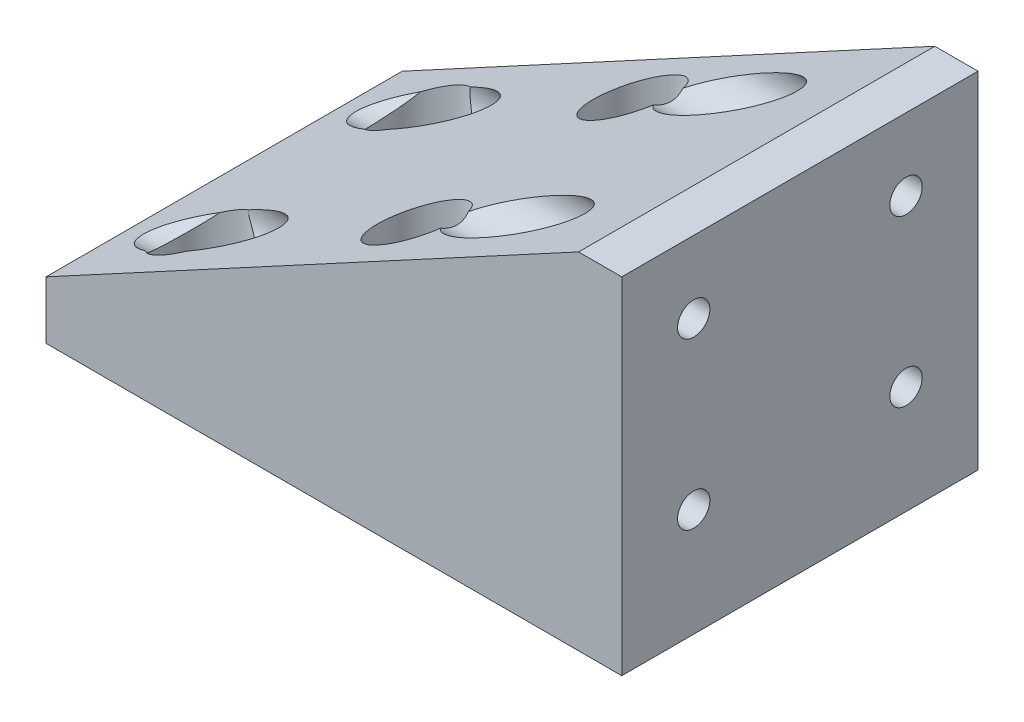
from build123d import *

# Parameters (mm, degrees)
BOSS_EXTRUDE1_DEPTH                           = 40
BOSS_EXTRUDE1_DEPTH_BACK                      = 8
SKETCH1_W                                     = 80
SKETCH1_H                                     = 49.5
CHAMFER1_SIZE                                 = 40
CHAMFER1_SIZE2                                = 74
CSK_FOR_M4_SFHCS1_AT_2_COUNT                  = 2
CSK_FOR_M4_SFHCS1_AT_2_PITCH                  = 30
CSK_FOR_M4_SFHCS1_AT_3_COUNT                  = 2
CSK_FOR_M4_SFHCS1_AT_3_PITCH                  = 42.426406871
CSK_FOR_M4_SFHCS1_AT_4_COUNT                  = 2
CSK_FOR_M4_SFHCS1_AT_4_PITCH                  = 30
SKETCH4_R                                     = 5.48
CUT_EXTRUDE1_DEPTH                            = 62.745951284
CSK_FOR_8_FLAT_HEAD_MACHINE_SCREW1_AT_2_COUNT = 2
CSK_FOR_8_FLAT_HEAD_MACHINE_SCREW1_AT_2_PITCH = 29.5
CSK_FOR_8_FLAT_HEAD_MACHINE_SCREW1_AT_3_COUNT = 2
CSK_FOR_8_FLAT_HEAD_MACHINE_SCREW1_AT_3_PITCH = 37.406550229
CSK_FOR_8_FLAT_HEAD_MACHINE_SCREW1_AT_4_COUNT = 2
CSK_FOR_8_FLAT_HEAD_MACHINE_SCREW1_AT_4_PITCH = 23
SKETCH7_R                                     = 5.0856896
CUT_EXTRUDE2_DEPTH                            = 87.842170056


with BuildPart() as part:
    # Sketch1 → Boss-Extrude1 (new, two sides: drawn at the far end of the back side and taken through both)
    with BuildSketch(Plane(origin=(0, 0, 0), x_dir=(1, 0, 0), z_dir=(0, 1, 0)).offset(-BOSS_EXTRUDE1_DEPTH_BACK)):
        Rectangle(SKETCH1_W, SKETCH1_H)
    extrude(amount=BOSS_EXTRUDE1_DEPTH + BOSS_EXTRUDE1_DEPTH_BACK)

    # Chamfer1
    chamfer1_edges = [part.edges().sort_by_distance(p)[0] for p in [
        (-40, 40, 0),
    ]]
    chamfer1_side = [part.faces().sort_by_distance(p)[0] for p in [
        (-40, 16, 0),
    ]]
    chamfer(chamfer1_edges, length=CHAMFER1_SIZE, length2=CHAMFER1_SIZE2, reference=chamfer1_side[0])

    # Sketch3 → CSK for M4 SFHCS1 (revolve, cut)
    with BuildSketch(Plane(origin=(-28.25, 0, -15), x_dir=(0, 0, 1), z_dir=(1, 0, 0))):
        Polygon((0, 0), (0, 8), (2.25, 8), (2.25, 3.23), (5.48, 0), align=None)
    csk_for_m4_sfhcs1 = revolve(axis=Axis((-28.25, 6.35, -15), (0, -1, 0)), mode=Mode.SUBTRACT)

    # CSK for M4 SFHCS1 at 2: CSK for M4 SFHCS1 ×2
    with Locations(*[(i * CSK_FOR_M4_SFHCS1_AT_2_PITCH, 0, 0) for i in range(1, CSK_FOR_M4_SFHCS1_AT_2_COUNT)]):
        add(csk_for_m4_sfhcs1, mode=Mode.SUBTRACT)

    # CSK for M4 SFHCS1 at 3: CSK for M4 SFHCS1 ×2
    with Locations(*[Vector(0.7071067811865476, 0, 0.7071067811865476) * (i * CSK_FOR_M4_SFHCS1_AT_3_PITCH) for i in range(1, CSK_FOR_M4_SFHCS1_AT_3_COUNT)]):
        add(csk_for_m4_sfhcs1, mode=Mode.SUBTRACT)

    # CSK for M4 SFHCS1 at 4: CSK for M4 SFHCS1 ×2
    with Locations(*[(0, 0, i * CSK_FOR_M4_SFHCS1_AT_4_PITCH) for i in range(1, CSK_FOR_M4_SFHCS1_AT_4_COUNT)]):
        add(csk_for_m4_sfhcs1, mode=Mode.SUBTRACT)

    # Sketch4 → Cut-Extrude1 (cut, through all)
    with BuildSketch(Plane.XZ):
        with Locations(Location((-28.25, -15, 0), (0, 0, 270))):
            Circle(SKETCH4_R)
        with Locations(Location((1.75, -15, 0), (0, 0, 270))):
            Circle(SKETCH4_R)
        with Locations(Location((1.75, 15, 0), (0, 0, 270))):
            Circle(SKETCH4_R)
        with Locations(Location((-28.25, 15, 0), (0, 0, 270))):
            Circle(SKETCH4_R)
    extrude(amount=-CUT_EXTRUDE1_DEPTH, mode=Mode.SUBTRACT)

    # Sketch6 → CSK for #8 Flat Head Machine Screw1 (revolve, cut)
    with BuildSketch(Plane(origin=(33, 30, 14.75), x_dir=(0, 0, 1), z_dir=(0, 1, 0))):
        Polygon((0, 0), (0, 7), (2.2479, 7), (2.2479, 3.264503502), (5.0856896, 0), align=None)
    csk_for_8_flat_head_machine_screw1 = revolve(axis=Axis((26.65, 30, 14.75), (1, 0, 0)), mode=Mode.SUBTRACT)

    # CSK for #8 Flat Head Machine Screw1 at 2: CSK for #8 Flat Head Machine Screw1 ×2
    with Locations(*[(0, 0, -i * CSK_FOR_8_FLAT_HEAD_MACHINE_SCREW1_AT_2_PITCH) for i in range(1, CSK_FOR_8_FLAT_HEAD_MACHINE_SCREW1_AT_2_COUNT)]):
        add(csk_for_8_flat_head_machine_screw1, mode=Mode.SUBTRACT)

    # CSK for #8 Flat Head Machine Screw1 at 3: CSK for #8 Flat Head Machine Screw1 ×2
    with Locations(*[Vector(0, -0.6148655745980577, -0.7886319326366391) * (i * CSK_FOR_8_FLAT_HEAD_MACHINE_SCREW1_AT_3_PITCH) for i in range(1, CSK_FOR_8_FLAT_HEAD_MACHINE_SCREW1_AT_3_COUNT)]):
        add(csk_for_8_flat_head_machine_screw1, mode=Mode.SUBTRACT)

    # CSK for #8 Flat Head Machine Screw1 at 4: CSK for #8 Flat Head Machine Screw1 ×2
    with Locations(*[(0, -i * CSK_FOR_8_FLAT_HEAD_MACHINE_SCREW1_AT_4_PITCH, 0) for i in range(1, CSK_FOR_8_FLAT_HEAD_MACHINE_SCREW1_AT_4_COUNT)]):
        add(csk_for_8_flat_head_machine_screw1, mode=Mode.SUBTRACT)

    # Sketch7 → Cut-Extrude2 (cut, through all)
    with BuildSketch(Plane(origin=(33, 0, 0), x_dir=(0, 0, -1), z_dir=(1, 0, 0))):
        with Locations((-14.75, 7)):
            Circle(SKETCH7_R)
        with Locations((14.75, 7)):
            Circle(SKETCH7_R)
        with Locations((14.75, 30)):
            Circle(SKETCH7_R)
        with Locations((-14.75, 30)):
            Circle(SKETCH7_R)
    extrude(amount=-CUT_EXTRUDE2_DEPTH, mode=Mode.SUBTRACT)


solid = part.part
